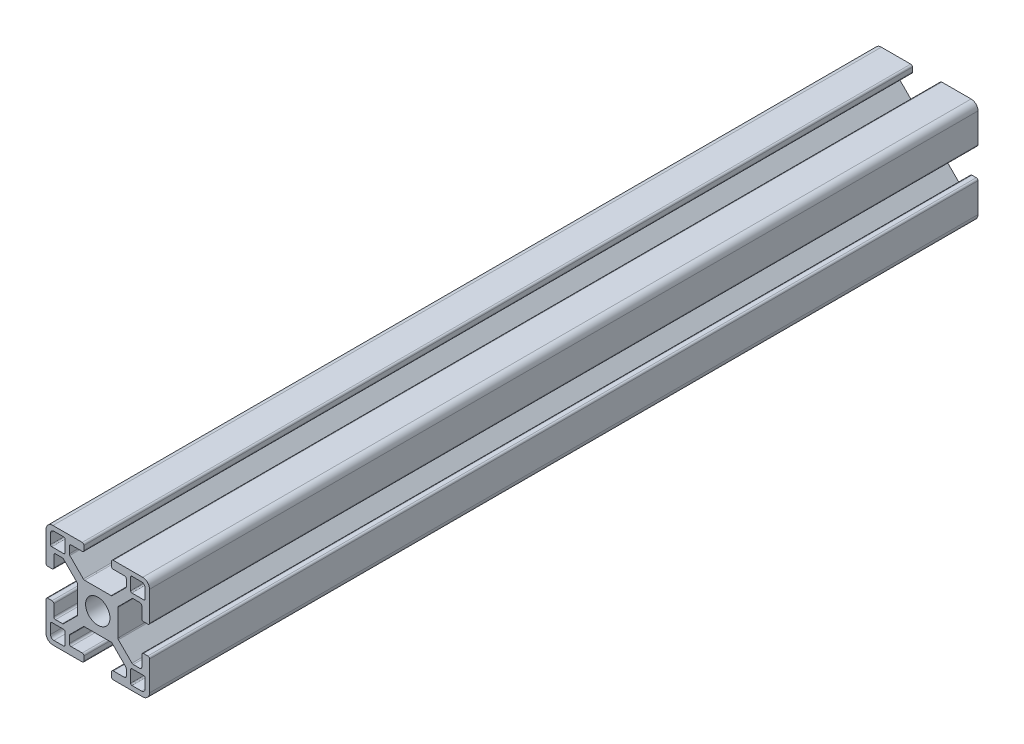
from build123d import *

# Parameters (mm, degrees)
SKETCH1_R           = 3.52998588
BOSS_EXTRUDE1_DEPTH = 120


with BuildPart() as part:
    # Sketch1 → Boss-Extrude1 (new, symmetric)
    with BuildSketch(Plane.XY):
        with BuildLine():
            Line((14.49994, -4), (13.24247465, -4))
            ThreePointArc((13.24247465, -4), (12.88892126, -4.146446609), (12.74247465, -4.5))
            Line((12.74247465, -4.5), (12.74247465, -7.732519321))
            ThreePointArc((12.74247465, -7.732519321), (12.602449697, -8.097296796), (12.242781236, -8.249967))
            Line((12.242781236, -8.249967), (10.260188032, -8.249967))
            ThreePointArc((10.260188032, -8.249967), (10.068847082, -8.211906919), (9.906636056, -8.103520976))
            Line((9.906636056, -8.103520976), (5.981117769, -4.178002689))
            ThreePointArc((5.981117769, -4.178002689), (5.872731827, -4.015791664), (5.834671745, -3.824450713))
            Line((5.834671745, -3.824450713), (5.834671745, -1.01249595))
            Line((5.834671745, -1.01249595), (5.834671745, 0.88749645))
            Line((5.834671745, 0.88749645), (5.834671745, 3.824450713))
            ThreePointArc((5.834671745, 3.824450713), (5.872731827, 4.015791664), (5.981117769, 4.178002689))
            Line((5.981117769, 4.178002689), (9.906636056, 8.103520976))
            ThreePointArc((9.906636056, 8.103520976), (10.068847082, 8.211906919), (10.260188032, 8.249967))
            Line((10.260188032, 8.249967), (12.242781236, 8.249967))
            ThreePointArc((12.242781236, 8.249967), (12.602449697, 8.097296796), (12.74247465, 7.732519321))
            Line((12.74247465, 7.732519321), (12.74247465, 4.5))
            ThreePointArc((12.74247465, 4.5), (12.88892126, 4.146446609), (13.24247465, 4))
            Line((13.24247465, 4), (14.49994, 4))
            ThreePointArc((14.49994, 4), (14.853493391, 4.146446609), (14.99994, 4.5))
            Line((14.99994, 4.5), (14.99994, 12.999948))
            ThreePointArc((14.99994, 12.999948), (14.414155906, 14.414155906), (12.999948, 14.99994))
            Line((12.999948, 14.99994), (4.5, 14.99994))
            ThreePointArc((4.5, 14.99994), (4.146446609, 14.853493391), (4, 14.49994))
            Line((4, 14.49994), (4, 13.24247465))
            ThreePointArc((4, 13.24247465), (4.146446609, 12.88892126), (4.5, 12.74247465))
            Line((4.5, 12.74247465), (7.732519321, 12.74247465))
            ThreePointArc((7.732519321, 12.74247465), (8.097296796, 12.602449697), (8.249967, 12.242781236))
            Line((8.249967, 12.242781236), (8.249967, 10.260188032))
            ThreePointArc((8.249967, 10.260188032), (8.211906919, 10.068847082), (8.103520976, 9.906636056))
            Line((8.103520976, 9.906636056), (4.178002689, 5.981117769))
            ThreePointArc((4.178002689, 5.981117769), (4.015791664, 5.872731827), (3.824450713, 5.834671745))
            Line((3.824450713, 5.834671745), (0.9499962, 5.834671745))
            Line((0.9499962, 5.834671745), (-0.9499962, 5.834671745))
            Line((-0.9499962, 5.834671745), (-3.824450713, 5.834671745))
            ThreePointArc((-3.824450713, 5.834671745), (-4.015791664, 5.872731827), (-4.178002689, 5.981117769))
            Line((-4.178002689, 5.981117769), (-8.103520976, 9.906636056))
            ThreePointArc((-8.103520976, 9.906636056), (-8.211906919, 10.068847082), (-8.249967, 10.260188032))
            Line((-8.249967, 10.260188032), (-8.249967, 12.242781236))
            ThreePointArc((-8.249967, 12.242781236), (-8.097296796, 12.602449697), (-7.732519321, 12.74247465))
            Line((-7.732519321, 12.74247465), (-4.5, 12.74247465))
            ThreePointArc((-4.5, 12.74247465), (-4.146446609, 12.88892126), (-4, 13.24247465))
            Line((-4, 13.24247465), (-4, 14.49994))
            ThreePointArc((-4, 14.49994), (-4.146446609, 14.853493391), (-4.5, 14.99994))
            Line((-4.5, 14.99994), (-12.999948, 14.99994))
            ThreePointArc((-12.999948, 14.99994), (-14.414155906, 14.414155906), (-14.99994, 12.999948))
            Line((-14.99994, 12.999948), (-14.99994, 4.5))
            ThreePointArc((-14.99994, 4.5), (-14.853493391, 4.146446609), (-14.49994, 4))
            Line((-14.49994, 4), (-13.24247465, 4))
            ThreePointArc((-13.24247465, 4), (-12.88892126, 4.146446609), (-12.74247465, 4.5))
            Line((-12.74247465, 4.5), (-12.74247465, 7.732519321))
            ThreePointArc((-12.74247465, 7.732519321), (-12.602449697, 8.097296796), (-12.242781236, 8.249967))
            Line((-12.242781236, 8.249967), (-10.260188032, 8.249967))
            ThreePointArc((-10.260188032, 8.249967), (-10.068847082, 8.211906919), (-9.906636056, 8.103520976))
            Line((-9.906636056, 8.103520976), (-5.981117769, 4.178002689))
            ThreePointArc((-5.981117769, 4.178002689), (-5.872731827, 4.015791664), (-5.834671745, 3.824450713))
            Line((-5.834671745, 3.824450713), (-5.834671745, 0.88749645))
            Line((-5.834671745, 0.88749645), (-5.834671745, -1.01249595))
            Line((-5.834671745, -1.01249595), (-5.834671745, -3.824450713))
            ThreePointArc((-5.834671745, -3.824450713), (-5.872731827, -4.015791664), (-5.981117769, -4.178002689))
            Line((-5.981117769, -4.178002689), (-9.906636056, -8.103520976))
            ThreePointArc((-9.906636056, -8.103520976), (-10.068847082, -8.211906919), (-10.260188032, -8.249967))
            Line((-10.260188032, -8.249967), (-12.242781236, -8.249967))
            ThreePointArc((-12.242781236, -8.249967), (-12.602449697, -8.097296796), (-12.74247465, -7.732519321))
            Line((-12.74247465, -7.732519321), (-12.74247465, -4.5))
            ThreePointArc((-12.74247465, -4.5), (-12.88892126, -4.146446609), (-13.24247465, -4))
            Line((-13.24247465, -4), (-14.49994, -4))
            ThreePointArc((-14.49994, -4), (-14.853493391, -4.146446609), (-14.99994, -4.5))
            Line((-14.99994, -4.5), (-14.99994, -12.999948))
            ThreePointArc((-14.99994, -12.999948), (-14.414155906, -14.414155906), (-12.999948, -14.99994))
            Line((-12.999948, -14.99994), (-4.5, -14.99994))
            ThreePointArc((-4.5, -14.99994), (-4.146446609, -14.853493391), (-4, -14.49994))
            Line((-4, -14.49994), (-4, -13.24247465))
            ThreePointArc((-4, -13.24247465), (-4.146446609, -12.88892126), (-4.5, -12.74247465))
            Line((-4.5, -12.74247465), (-7.732519321, -12.74247465))
            ThreePointArc((-7.732519321, -12.74247465), (-8.097296796, -12.602449697), (-8.249967, -12.242781236))
            Line((-8.249967, -12.242781236), (-8.249967, -10.260188032))
            ThreePointArc((-8.249967, -10.260188032), (-8.211906919, -10.068847082), (-8.103520976, -9.906636056))
            Line((-8.103520976, -9.906636056), (-4.178002689, -5.981117769))
            ThreePointArc((-4.178002689, -5.981117769), (-4.015791664, -5.872731827), (-3.824450713, -5.834671745))
            Line((-3.824450713, -5.834671745), (-0.9499962, -5.834671745))
            Line((-0.9499962, -5.834671745), (0.9499962, -5.834671745))
            Line((0.9499962, -5.834671745), (3.824450713, -5.834671745))
            ThreePointArc((3.824450713, -5.834671745), (4.015791664, -5.872731827), (4.178002689, -5.981117769))
            Line((4.178002689, -5.981117769), (8.103520976, -9.906636056))
            ThreePointArc((8.103520976, -9.906636056), (8.211906919, -10.068847082), (8.249967, -10.260188032))
            Line((8.249967, -10.260188032), (8.249967, -12.242781236))
            ThreePointArc((8.249967, -12.242781236), (8.097296796, -12.602449697), (7.732519321, -12.74247465))
            Line((7.732519321, -12.74247465), (4.5, -12.74247465))
            ThreePointArc((4.5, -12.74247465), (4.146446609, -12.88892126), (4, -13.24247465))
            Line((4, -13.24247465), (4, -14.49994))
            ThreePointArc((4, -14.49994), (4.146446609, -14.853493391), (4.5, -14.99994))
            Line((4.5, -14.99994), (12.999948, -14.99994))
            ThreePointArc((12.999948, -14.99994), (14.414155906, -14.414155906), (14.99994, -12.999948))
            Line((14.99994, -12.999948), (14.99994, -4.5))
            ThreePointArc((14.99994, -4.5), (14.853493391, -4.146446609), (14.49994, -4))
        make_face()
        Circle(SKETCH1_R, mode=Mode.SUBTRACT)
        with BuildLine():
            Line((-12.6999492, -13.6999452), (-9.880960476, -13.6999452))
            ThreePointArc((-9.880960476, -13.6999452), (-9.61155387, -13.58835333), (-9.499962, -13.318946724))
            Line((-9.499962, -13.318946724), (-9.499962, -9.87996048))
            ThreePointArc((-9.499962, -9.87996048), (-9.611260978, -9.611260978), (-9.87996048, -9.499962))
            Line((-9.87996048, -9.499962), (-13.318946724, -9.499962))
            ThreePointArc((-13.318946724, -9.499962), (-13.58835333, -9.61155387), (-13.6999452, -9.880960476))
            Line((-13.6999452, -9.880960476), (-13.6999452, -12.6999492))
            ThreePointArc((-13.6999452, -12.6999492), (-13.407053153, -13.407053153), (-12.6999492, -13.6999452))
        make_face(mode=Mode.SUBTRACT)
        with BuildLine():
            Line((13.6999452, -12.6999492), (13.6999452, -9.880960476))
            ThreePointArc((13.6999452, -9.880960476), (13.58835333, -9.61155387), (13.318946724, -9.499962))
            Line((13.318946724, -9.499962), (9.87996048, -9.499962))
            ThreePointArc((9.87996048, -9.499962), (9.611260978, -9.611260978), (9.499962, -9.87996048))
            Line((9.499962, -9.87996048), (9.499962, -13.318946724))
            ThreePointArc((9.499962, -13.318946724), (9.61155387, -13.58835333), (9.880960476, -13.6999452))
            Line((9.880960476, -13.6999452), (12.6999492, -13.6999452))
            ThreePointArc((12.6999492, -13.6999452), (13.407053153, -13.407053153), (13.6999452, -12.6999492))
        make_face(mode=Mode.SUBTRACT)
        with BuildLine():
            Line((9.87996048, 9.499962), (13.318946724, 9.499962))
            ThreePointArc((13.318946724, 9.499962), (13.58835333, 9.61155387), (13.6999452, 9.880960476))
            Line((13.6999452, 9.880960476), (13.6999452, 12.6999492))
            ThreePointArc((13.6999452, 12.6999492), (13.407053153, 13.407053153), (12.6999492, 13.6999452))
            Line((12.6999492, 13.6999452), (9.880960476, 13.6999452))
            ThreePointArc((9.880960476, 13.6999452), (9.61155387, 13.58835333), (9.499962, 13.318946724))
            Line((9.499962, 13.318946724), (9.499962, 9.87996048))
            ThreePointArc((9.499962, 9.87996048), (9.611260978, 9.611260978), (9.87996048, 9.499962))
        make_face(mode=Mode.SUBTRACT)
        with BuildLine():
            Line((-13.6999452, 12.6999492), (-13.6999452, 9.880960476))
            ThreePointArc((-13.6999452, 9.880960476), (-13.58835333, 9.61155387), (-13.318946724, 9.499962))
            Line((-13.318946724, 9.499962), (-9.87996048, 9.499962))
            ThreePointArc((-9.87996048, 9.499962), (-9.611260978, 9.611260978), (-9.499962, 9.87996048))
            Line((-9.499962, 9.87996048), (-9.499962, 13.318946724))
            ThreePointArc((-9.499962, 13.318946724), (-9.61155387, 13.58835333), (-9.880960476, 13.6999452))
            Line((-9.880960476, 13.6999452), (-12.6999492, 13.6999452))
            ThreePointArc((-12.6999492, 13.6999452), (-13.407053153, 13.407053153), (-13.6999452, 12.6999492))
        make_face(mode=Mode.SUBTRACT)
    extrude(amount=BOSS_EXTRUDE1_DEPTH, both=True)


solid = part.part
